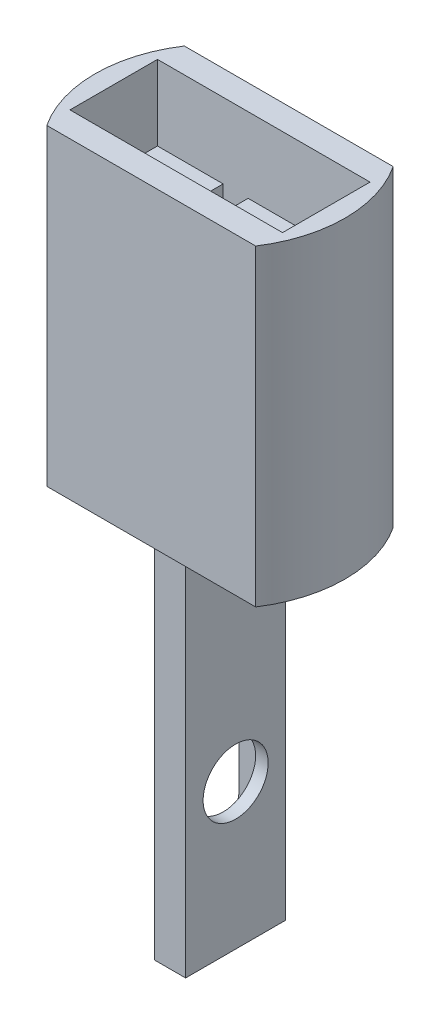
from build123d import *

# Parameters (mm, degrees)
SKETCH3_R           = 10
BOSS_EXTRUDE1_DEPTH = 25
SKETCH4_W           = 2.5
SKETCH4_H           = 8
BOSS_EXTRUDE2_DEPTH = 30
CUT_EXTRUDE1_REACH  = 35.564
SKETCH5_R           = 2.6
SKETCH7_W           = 17
SKETCH7_H           = 7
CUT_EXTRUDE3_DEPTH  = 6
SKETCH8_W           = 2
SKETCH8_H           = 7
CUT_EXTRUDE4_DEPTH  = 4
SKETCH11_W          = 5.5
SKETCH11_H          = 21
CUT_EXTRUDE7_DEPTH  = 1.5
CUT_EXTRUDE5_DEPTH  = 43
BOSS_EXTRUDE3_DEPTH = 1.5


with BuildPart() as part:
    # Sketch3 → Boss-Extrude1 (new body)
    with BuildSketch(Plane(origin=(0, 0, 0), x_dir=(1, 0, 0), z_dir=(0, 1, 0))):
        with Locations(Location((0, 0, 0), (0, 0, 270))):
            Circle(SKETCH3_R)
    extrude(amount=BOSS_EXTRUDE1_DEPTH)

    # Sketch4 → Boss-Extrude2 (add)
    with BuildSketch(Plane(origin=(0, 0, 0), x_dir=(-1, 0, 0), z_dir=(0, -1, 0))):
        Rectangle(SKETCH4_W, SKETCH4_H)
    extrude(amount=BOSS_EXTRUDE2_DEPTH)

    # Sketch5 → Cut-Extrude1 (cut, up to next)
    with BuildSketch(Plane(origin=(1.25, 0, 0), x_dir=(0, 0, -1), z_dir=(1, 0, 0)), mode=Mode.PRIVATE) as cut_extrude1_sk1:
        with Locations((0, -18.4)):
            Circle(SKETCH5_R)
    cut_extrude1_tool1 = extrude(cut_extrude1_sk1.sketch, amount=-CUT_EXTRUDE1_REACH, mode=Mode.PRIVATE) & part.part
    add(cut_extrude1_tool1.solids().sort_by_distance((1.25, -18.4, 0))[0], mode=Mode.SUBTRACT)

    # Sketch7 → Cut-Extrude3 (cut)
    with BuildSketch(Plane(origin=(0, 25, 0), x_dir=(1, 0, 0), z_dir=(0, 1, 0))):
        Rectangle(SKETCH7_W, SKETCH7_H)
    extrude(amount=-CUT_EXTRUDE3_DEPTH, mode=Mode.SUBTRACT)

    # Sketch8 → Cut-Extrude4 (cut)
    with BuildSketch(Plane(origin=(0, 19, 0), x_dir=(1, 0, 0), z_dir=(0, 1, 0))):
        with Locations((-2.25, 0)):
            Rectangle(SKETCH8_W, SKETCH8_H)
    extrude(amount=-CUT_EXTRUDE4_DEPTH, mode=Mode.SUBTRACT)

    # Sketch11 → Cut-Extrude7 (cut)
    with BuildSketch(Plane.ZY.offset(1.25)):
        with Locations((0, -18.4)):
            Rectangle(SKETCH11_W, SKETCH11_H)
    extrude(amount=-CUT_EXTRUDE7_DEPTH, mode=Mode.SUBTRACT)

    # Sketch9 → Cut-Extrude5 (cut)
    with BuildSketch(Plane.XZ):
        with BuildLine():
            Line((8.351646544, -5.5), (-8.351646544, -5.5))
            ThreePointArc((-8.351646544, -5.5), (0, -10), (8.351646544, -5.5))
        make_face()
        with BuildLine():
            Line((8.351646544, 5.5), (-8.351646544, 5.5))
            ThreePointArc((-8.351646544, 5.5), (0, 10), (8.351646544, 5.5))
        make_face()
    extrude(amount=-CUT_EXTRUDE5_DEPTH, mode=Mode.SUBTRACT)

    # Sketch10 → Boss-Extrude3 (add)
    with BuildSketch(Plane.ZY.offset(1.25)):
        Polygon((-2.749970665, -28.900023923), (-2.749970665, -21.900023923), (-1.499970665, -28.900023923), align=None)
        Polygon((1.499970665, -28.900023923), (2.749970665, -28.900023923), (2.749970665, -21.900023923), align=None)
        Polygon((2.749970665, -7.899976077), (2.749970665, -14.899976077), (1.499970665, -7.899976077), align=None)
        Polygon((-1.499970665, -7.899976077), (-2.749970665, -7.899976077), (-2.749970665, -14.899976077), align=None)
    extrude(amount=-BOSS_EXTRUDE3_DEPTH)


solid = part.part
